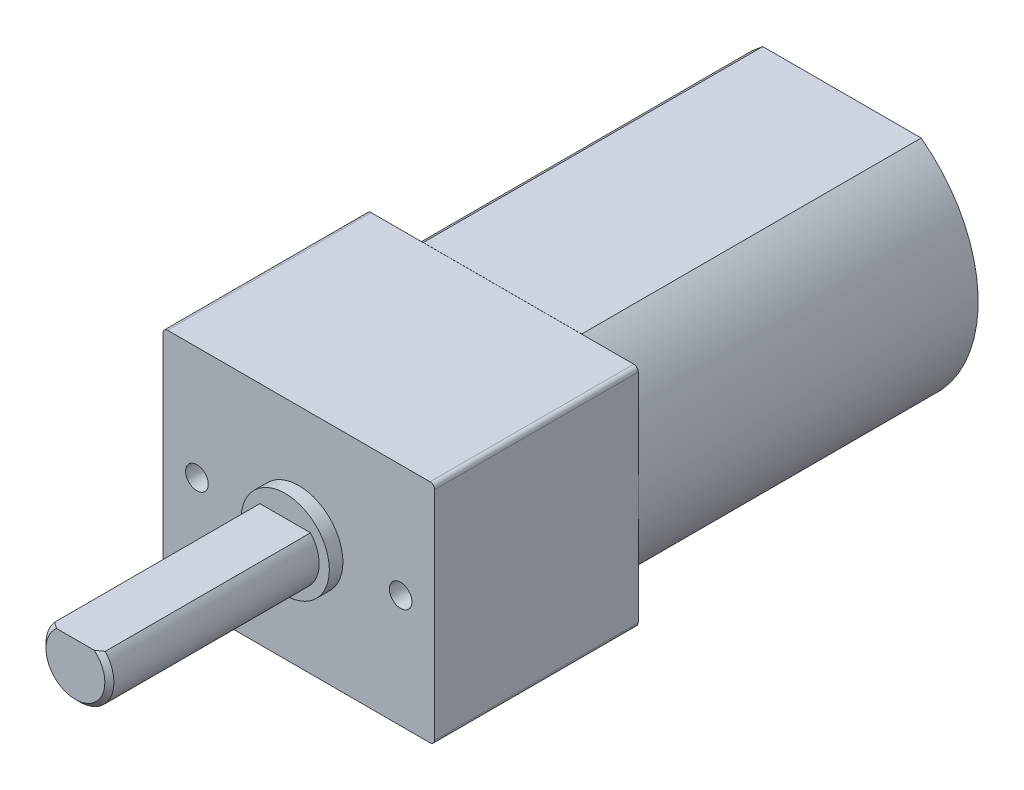
from build123d import *

# Parameters (mm, degrees)
SALIENTE_EXTRUIR1_DEPTH = 15
CROQUIS2_R              = 2.5
SALIENTE_EXTRUIR2_DEPTH = 1
CROQUIS3_W              = 12
CROQUIS3_H              = 9.99
SALIENTE_EXTRUIR3_DEPTH = 9
REDONDEO1_R             = 0.2
CROQUIS4_R              = 1.95
SALIENTE_EXTRUIR4_DEPTH = 0.6
SALIENTE_EXTRUIR5_DEPTH = 9.27
CHAFL_N1_SIZE           = 0.2
CROQUIS6_R              = 0.5
CORTAR_EXTRUIR1_DEPTH   = 2


with BuildPart() as part:
    # Croquis1 → Saliente-Extruir1 (new body)
    with BuildSketch(Plane.XY):
        with BuildLine():
            Line((-3.5, -5), (3.5, -5))
            ThreePointArc((3.5, -5), (6.019255673, 0), (3.5, 5))
            Line((3.5, 5), (-3.5, 5))
            ThreePointArc((-3.5, 5), (-5.980744327, 0), (-3.5, -5))
        make_face()
    extrude(amount=SALIENTE_EXTRUIR1_DEPTH)

    # Croquis2 → Saliente-Extruir2 (add)
    with BuildSketch(Plane(origin=(0, 0, 0), x_dir=(-1, 0, 0), z_dir=(0, 0, -1))):
        Circle(CROQUIS2_R)
    extrude(amount=SALIENTE_EXTRUIR2_DEPTH)

    # Croquis3 → Saliente-Extruir3 (add)
    with BuildSketch(Plane.XY.offset(15)):
        Rectangle(CROQUIS3_W, CROQUIS3_H)
    extrude(amount=SALIENTE_EXTRUIR3_DEPTH)

    # Redondeo1
    redondeo1_edges = [part.edges().sort_by_distance(p)[0] for p in [
        (6, -4.995, 19.5),
        (6, 4.995, 19.5),
        (-6, 4.995, 19.5),
        (-6, -4.995, 19.5),
    ]]
    fillet(redondeo1_edges, radius=REDONDEO1_R)

    # Croquis4 → Saliente-Extruir4 (add)
    with BuildSketch(Plane.XY.offset(24)):
        Circle(CROQUIS4_R)
    extrude(amount=SALIENTE_EXTRUIR4_DEPTH)

    # Croquis5 → Saliente-Extruir5 (add)
    with BuildSketch(Plane.XY.offset(24.6)):
        with BuildLine():
            Line((-1.118033989, 1), (1.118033989, 1))
            ThreePointArc((1.118033989, 1), (0, -1.5), (-1.118033989, 1))
        make_face()
    extrude(amount=SALIENTE_EXTRUIR5_DEPTH)

    # Chaflán1
    chafl_n1_edges = [part.edges().sort_by_distance(p)[0] for p in [
        (0, -1.5, 33.87),
    ]]
    chamfer(chafl_n1_edges, length=CHAFL_N1_SIZE)

    # Croquis6 → Cortar-Extruir1 (cut)
    with BuildSketch(Plane.XY.offset(24)):
        with Locations((-4.5, 0)):
            Circle(CROQUIS6_R)
        with Locations((4.5, 0)):
            Circle(CROQUIS6_R)
    extrude(amount=-CORTAR_EXTRUIR1_DEPTH, mode=Mode.SUBTRACT)


solid = part.part
